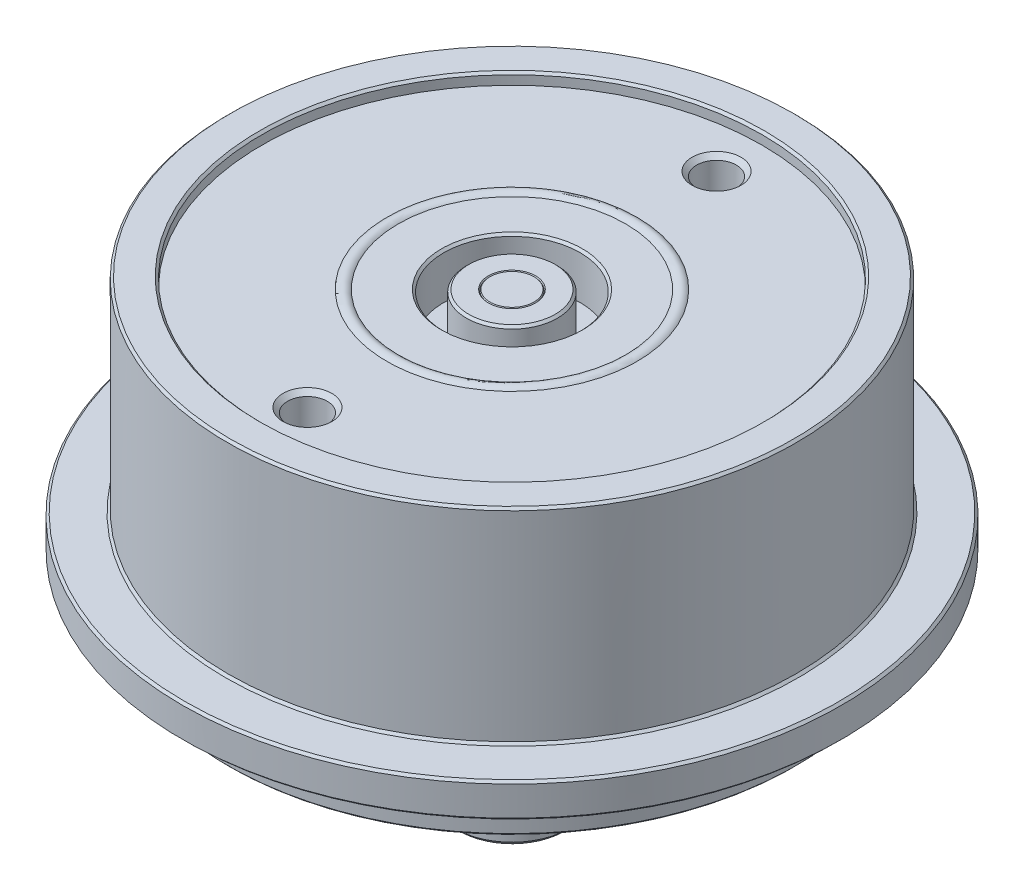
from build123d import *

# Parameters (mm, degrees)
SKETCH11_R          = 1.6
CUT_EXTRUDE11_DEPTH = 8
CHAMFER5_SIZE       = 0.2
SKETCH13_R          = 1.75
CUT_EXTRUDE13_DEPTH = 8
CHAMFER4_SIZE       = 0.4


with BuildPart() as part:
    # Sketch1 → Base-Revolve (revolve)
    with BuildSketch(Plane.XY, mode=Mode.PRIVATE) as base_revolve_sk:
        with BuildLine():
            Line((22, 24), (22, 25))
            Line((22, 25), (25, 25))
            Line((25, 25), (25, 7))
            Line((25, 7), (29, 7))
            Line((29, 7), (29, 4))
            Line((29, 4), (25, 4))
            Line((25, 4), (25, 0))
            Line((25, 0), (15, 0))
            Line((15, 0), (15, 0.1))
            Line((15, 0.1), (14.873999475, 0))
            Line((14.873999475, 0), (12.721791982, 0))
            Line((12.721791982, 0), (12.574111279, 0.1))
            Line((12.574111279, 0.1), (12.45924851, 0.1))
            Line((12.45924851, 0.1), (12.357749883, 0))
            Line((12.357749883, 0), (11.190176325, 0))
            Line((11.190176325, 0), (7.701985053, 0))
            Line((7.701985053, 0), (7.511808728, 0.121233853))
            Line((7.511808728, 0.121233853), (7.364301677, 0.121233853))
            Line((7.364301677, 0.121233853), (7.243067824, 0))
            Line((7.243067824, 0), (5.1, 0))
            Line((5.1, 0), (5, 0.1))
            Line((5, 0.1), (5, 0))
            Line((5, 0), (5, -15))
            Line((5, -15), (0, -15))
            Line((0, -15), (0, 24))
            Line((0, 24), (1.934523123, 24))
            Line((1.934523123, 24), (2, 23.918490551))
            Line((2, 23.918490551), (2.075283648, 24))
            Line((2.075283648, 24), (4, 24))
            Line((4, 24), (4, 20))
            Line((4, 20), (6, 20))
            Line((6, 20), (6, 24))
            Line((6, 24), (10, 24))
            ThreePointArc((10, 24), (10.5, 24.207106781), (11, 24))
            Line((11, 24), (22, 24))
        make_face()
    revolve(base_revolve_sk.sketch.rotate(Axis((0, 0, 0), (0, 1, 0)), 90), axis=Axis((0, 0, 0), (0, 1, 0)))

    # Sketch11 → Cut-Extrude11 (cut)
    with BuildSketch(Plane.XZ):
        with Locations(Location((-21, 0, 0), (0, 0, 270))):
            Circle(SKETCH11_R)
        with Locations(Location((10.5, 18.186533479, 0), (0, 0, 270))):
            Circle(SKETCH11_R)
        with Locations(Location((10.5, -18.186533479, 0), (0, 0, 270))):
            Circle(SKETCH11_R)
    extrude(amount=-CUT_EXTRUDE11_DEPTH, mode=Mode.SUBTRACT)

    # Cut-Extrude12 cone 1 section (through the dimple's axis) → Cut-Extrude12 (revolve, cut)
    with BuildSketch(Plane(origin=(10.5, 8, -18.186533479), x_dir=(0, 0, -1), z_dir=(1, 0, 0))):
        Polygon((0, 0), (1.6, 0), (0, 0.923760431), align=None)
    revolve(axis=Axis((10.5, 8, -18.186533479), (0, 1, 0)), mode=Mode.SUBTRACT)

    # Cut-Extrude12 cone 2 section (through the dimple's axis) → Cut-Extrude12 cone 2 (revolve, cut)
    with BuildSketch(Plane(origin=(-21, 8, 0), x_dir=(0, 0, -1), z_dir=(1, 0, 0))):
        Polygon((0, 0), (1.6, 0), (0, 0.923760431), align=None)
    revolve(axis=Axis((-21, 8, 0), (0, 1, 0)), mode=Mode.SUBTRACT)

    # Cut-Extrude12 cone 3 section (through the dimple's axis) → Cut-Extrude12 cone 3 (revolve, cut)
    with BuildSketch(Plane(origin=(10.5, 8, 18.186533479), x_dir=(0, 0, -1), z_dir=(1, 0, 0))):
        Polygon((0, 0), (1.6, 0), (0, 0.923760431), align=None)
    revolve(axis=Axis((10.5, 8, 18.186533479), (0, 1, 0)), mode=Mode.SUBTRACT)

    # Chamfer5
    chamfer5_edges = [part.edges().sort_by_distance(p)[0] for p in [
        (0, 25, 25),
        (0, 25, 22),
        (0, 24, 6),
        (0, 24, 4),
        (0, 0, 25),
        (0, 4, 25),
        (0, 4, 29),
        (0, 7, 29),
        (0, 7, 25),
    ]]
    chamfer(chamfer5_edges, length=CHAMFER5_SIZE)

    # Sketch13 → Cut-Extrude13 (cut)
    with BuildSketch(Plane(origin=(0, 24, 0), x_dir=(-1, 0, 0), z_dir=(0, 1, 0))):
        with Locations(Location((0, -18, 0), (0, 0, 90))):
            Circle(SKETCH13_R)
        with Locations(Location((0, 18, 0), (0, 0, 90))):
            Circle(SKETCH13_R)
    extrude(amount=-CUT_EXTRUDE13_DEPTH, mode=Mode.SUBTRACT)

    # Cut-Extrude14 cone 1 section (through the dimple's axis) → Cut-Extrude14 (revolve, cut)
    with BuildSketch(Plane(origin=(0, 16, -18), x_dir=(0, 0, 1), z_dir=(1, 0, 0))):
        Polygon((0, 0), (1.75, 0), (0, 1.225363192), align=None)
    revolve(axis=Axis((0, 16, -18), (0, -1, 0)), mode=Mode.SUBTRACT)

    # Cut-Extrude14 cone 2 section (through the dimple's axis) → Cut-Extrude14 cone 2 (revolve, cut)
    with BuildSketch(Plane(origin=(0, 16, 18), x_dir=(0, 0, 1), z_dir=(1, 0, 0))):
        Polygon((0, 0), (1.75, 0), (0, 1.225363192), align=None)
    revolve(axis=Axis((0, 16, 18), (0, -1, 0)), mode=Mode.SUBTRACT)

    # Chamfer4
    chamfer4_edges = [part.edges().sort_by_distance(p)[0] for p in [
        (0, 24, -19.75),
        (0, 24, 16.25),
        (0, -15, 5),
        (-21, 0, 1.6),
        (10.5, 0, 19.786533479),
        (10.5, 0, -16.586533479),
    ]]
    chamfer(chamfer4_edges, length=CHAMFER4_SIZE)


solid = part.part
